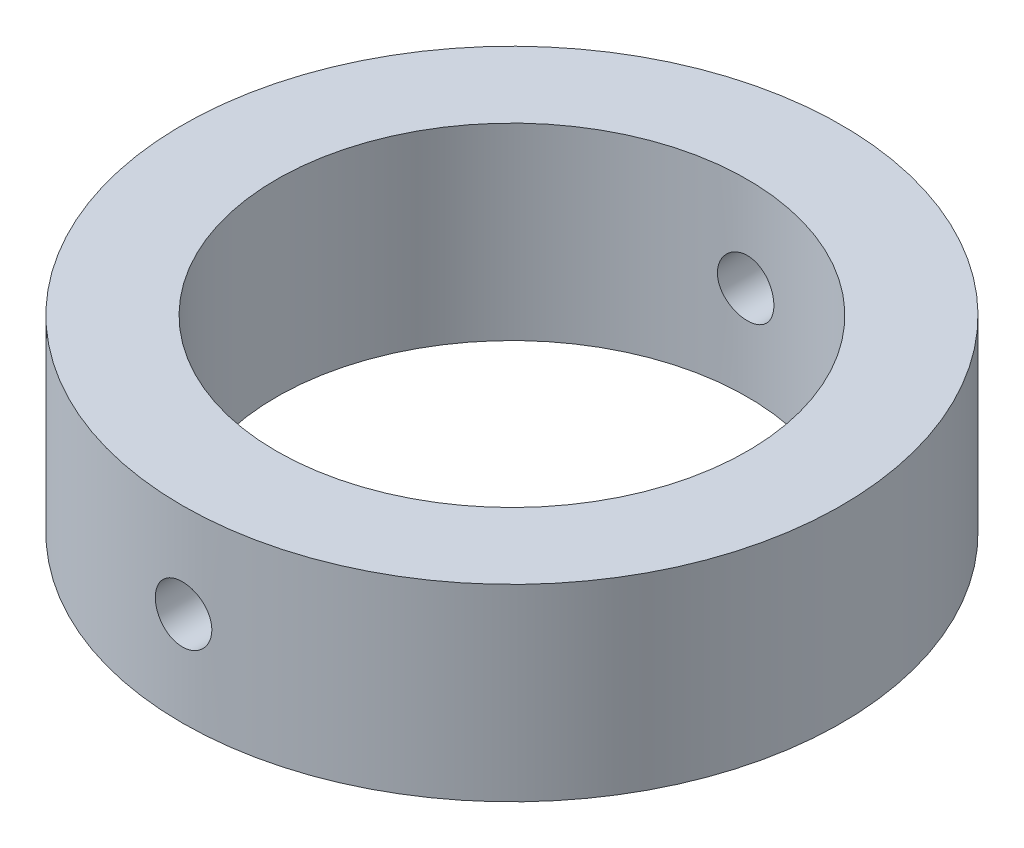
from build123d import *

# Parameters (mm, degrees)
SKETCH1_R           = 350
SKETCH1_R_2         = 250
BOSS_EXTRUDE1_DEPTH = 200
SKETCH2_R           = 30
CUT_EXTRUDE1_DEPTH  = 453.5


with BuildPart() as part:
    # Sketch1 → Boss-Extrude1 (new body)
    with BuildSketch(Plane(origin=(0, 0, 0), x_dir=(1, 0, 0), z_dir=(0, 1, 0))):
        with Locations(Location((0, 0, 0), (0, 0, 270))):
            Circle(SKETCH1_R)
        with Locations(Location((0, 0, 0), (0, 0, 270))):
            Circle(SKETCH1_R_2, mode=Mode.SUBTRACT)
    extrude(amount=BOSS_EXTRUDE1_DEPTH)

    # Sketch2 → Cut-Extrude1 (cut, symmetric)
    with BuildSketch(Plane.XY):
        with Locations((0, 100)):
            Circle(SKETCH2_R)
    extrude(amount=CUT_EXTRUDE1_DEPTH, both=True, mode=Mode.SUBTRACT)


solid = part.part
